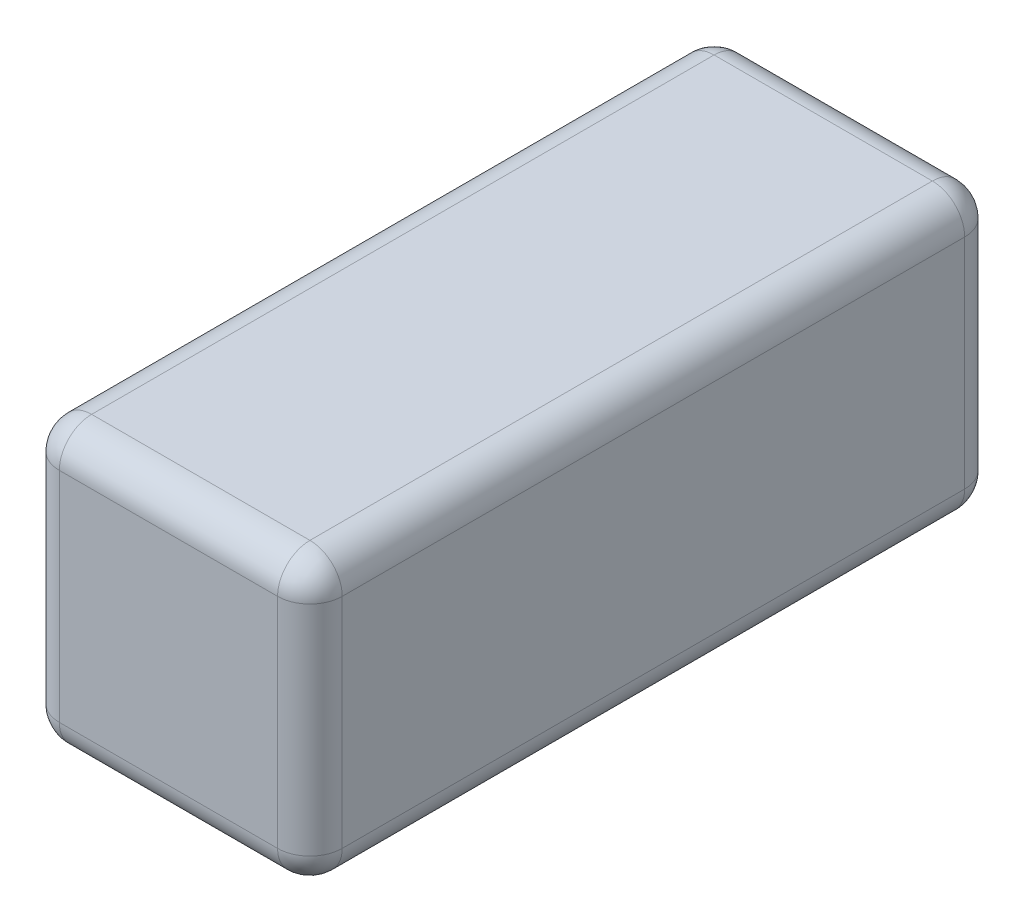
from build123d import *

# Parameters (mm, degrees)
SKETCH1_W           = 70
SKETCH1_H           = 70
BOSS_EXTRUDE1_DEPTH = 170
FILLET1_R           = 8


with BuildPart() as part:
    # Sketch1 → Boss-Extrude1 (new body)
    with BuildSketch(Plane.XY):
        Rectangle(SKETCH1_W, SKETCH1_H)
    extrude(amount=BOSS_EXTRUDE1_DEPTH)

    # Fillet1
    fillet1_edges = [part.edges().sort_by_distance(p)[0] for p in [
        (-35, 0, 170),
        (0, -35, 170),
        (35, 0, 170),
        (0, -35, 0),
        (-35, 0, 0),
        (0, 35, 0),
        (35, 0, 0),
        (35, -35, 85),
        (-35, -35, 85),
        (-35, 35, 85),
        (35, 35, 85),
        (0, 35, 170),
    ]]
    fillet(fillet1_edges, radius=FILLET1_R)


solid = part.part
